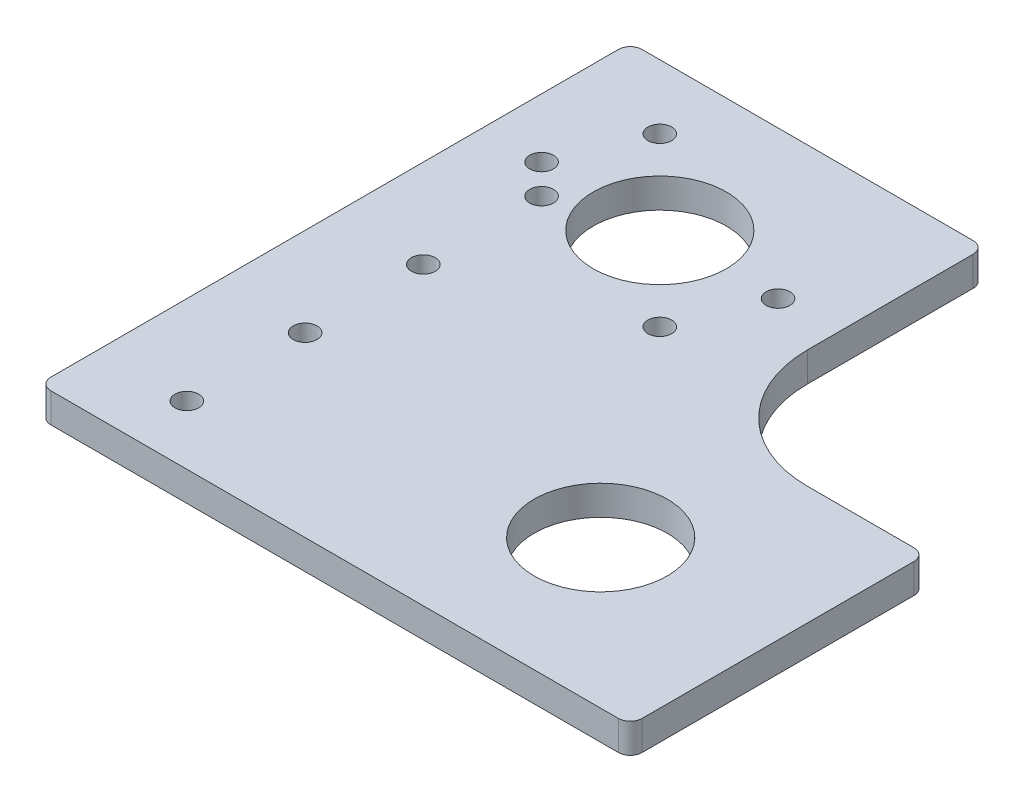
from build123d import *

# Parameters (mm, degrees)
SKETCH1_W           = 127
SKETCH1_H           = 127
BOSS_EXTRUDE1_DEPTH = 6.35
SKETCH2_W           = 50.8
SKETCH2_H           = 63.5
CUT_EXTRUDE1_DEPTH  = 180.717340566
SKETCH3_R           = 14.3002
CUT_EXTRUDE2_DEPTH  = 180.717340566
SKETCH5_R           = 2.5527
CUT_EXTRUDE4_DEPTH  = 180.717340566
CIRPATTERN1_COUNT   = 8
SKETCH6_R           = 14.3002
CUT_EXTRUDE5_DEPTH  = 180.717340566
FILLET1_R           = 2.54
FILLET2_R           = 25.4
SKETCH10_R          = 2.5527
CUT_EXTRUDE7_DEPTH  = 180.717340566
LPATTERN1_COUNT     = 5
LPATTERN1_PITCH     = 25.4


with BuildPart() as part:
    # Sketch1 → Boss-Extrude1 (new body)
    with BuildSketch(Plane(origin=(0, 0, 0), x_dir=(1, 0, 0), z_dir=(0, 1, 0))):
        with Locations((-63.5, 63.5)):
            Rectangle(SKETCH1_W, SKETCH1_H)
    extrude(amount=BOSS_EXTRUDE1_DEPTH)

    # Sketch2 → Cut-Extrude1 (cut, through all)
    with BuildSketch(Plane(origin=(0, 6.35, 0), x_dir=(1, 0, 0), z_dir=(0, 1, 0))):
        with Locations((-25.4, 95.25)):
            Rectangle(SKETCH2_W, SKETCH2_H)
    extrude(amount=-CUT_EXTRUDE1_DEPTH, mode=Mode.SUBTRACT)

    # Sketch3 → Cut-Extrude2 (cut, through all)
    with BuildSketch(Plane(origin=(0, 6.35, 0), x_dir=(1, 0, 0), z_dir=(0, 1, 0))):
        with Locations((-38.1, 31.75)):
            Circle(SKETCH3_R)
    extrude(amount=-CUT_EXTRUDE2_DEPTH, mode=Mode.SUBTRACT)

    # Sketch5 → Cut-Extrude4 (cut, through all)
    with BuildSketch(Plane(origin=(0, 6.35, 0), x_dir=(1, 0, 0), z_dir=(0, 1, 0))):
        with Locations((-114.3, 95.25)):
            Circle(SKETCH5_R)
    cut_extrude4 = extrude(amount=-CUT_EXTRUDE4_DEPTH, mode=Mode.SUBTRACT)

    # CirPattern1: Cut-Extrude4 ×8 about axis, 4 skipped
    cirpattern1_axis = Axis((-88.9, 6.35, -95.25), (0, 1, 0))
    add([cut_extrude4.rotate(cirpattern1_axis, i * 360 / CIRPATTERN1_COUNT) for i in range(1, CIRPATTERN1_COUNT) if i not in (1, 2, 5, 6)], mode=Mode.SUBTRACT)

    # Sketch6 → Cut-Extrude5 (cut, through all)
    with BuildSketch(Plane(origin=(0, 6.35, 0), x_dir=(1, 0, 0), z_dir=(0, 1, 0))):
        with Locations((-88.9, 95.25)):
            Circle(SKETCH6_R)
    extrude(amount=-CUT_EXTRUDE5_DEPTH, mode=Mode.SUBTRACT)

    # Fillet1
    fillet1_edges = [part.edges().sort_by_distance(p)[0] for p in [
        (-127, 3.175, 0),
        (0, 3.175, 0),
        (0, 3.175, -63.5),
        (-50.8, 3.175, -127),
        (-127, 3.175, -127),
    ]]
    fillet(fillet1_edges, radius=FILLET1_R)

    # Fillet2
    fillet2_edges = [part.edges().sort_by_distance(p)[0] for p in [
        (-50.8, 3.175, -63.5),
    ]]
    fillet(fillet2_edges, radius=FILLET2_R)

    # Sketch10 → Cut-Extrude7 (cut, through all)
    with BuildSketch(Plane(origin=(0, 6.35, 0), x_dir=(1, 0, 0), z_dir=(0, 1, 0))):
        with Locations((-107.95, 12.7)):
            Circle(SKETCH10_R)
    cut_extrude7 = extrude(amount=-CUT_EXTRUDE7_DEPTH, mode=Mode.SUBTRACT)

    # LPattern1: Cut-Extrude7 ×5, 1 skipped
    with Locations(*[(0, 0, -i * LPATTERN1_PITCH) for i in range(1, LPATTERN1_COUNT) if i not in (4,)]):
        add(cut_extrude7, mode=Mode.SUBTRACT)


solid = part.part
